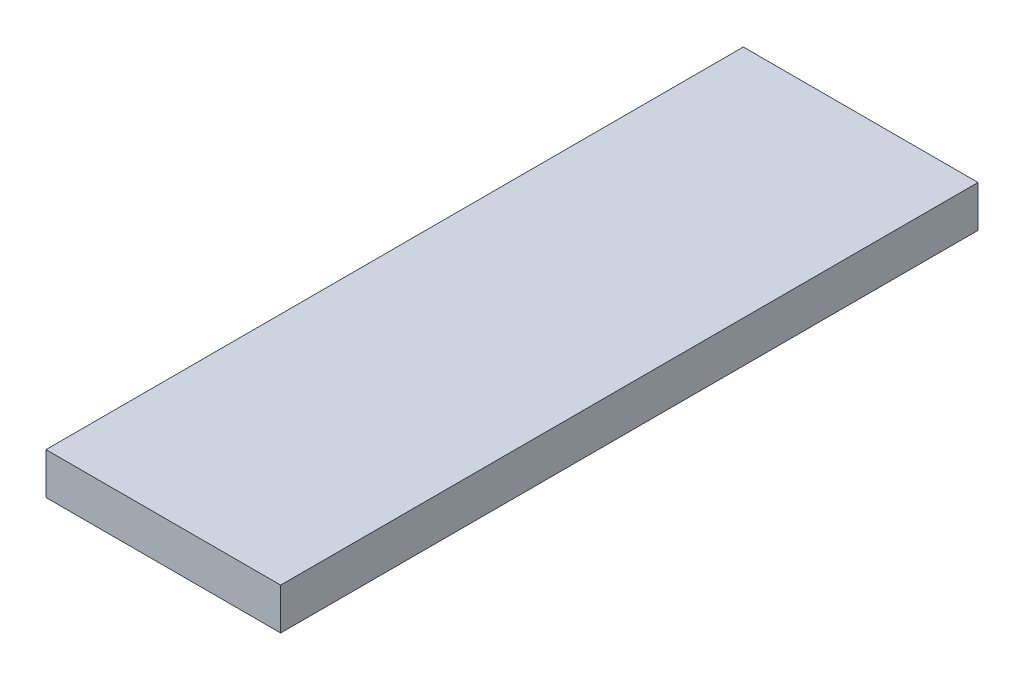
from build123d import *

# Parameters (mm, degrees)
SKETCH1_W           = 53.848
SKETCH1_H           = 160.02
BOSS_EXTRUDE1_DEPTH = 9.525


with BuildPart() as part:
    # Sketch1 → Boss-Extrude1 (new body)
    with BuildSketch(Plane(origin=(0, 0, 0), x_dir=(1, 0, 0), z_dir=(0, 1, 0))):
        with Locations((26.924, 80.01)):
            Rectangle(SKETCH1_W, SKETCH1_H)
    extrude(amount=BOSS_EXTRUDE1_DEPTH)


solid = part.part
